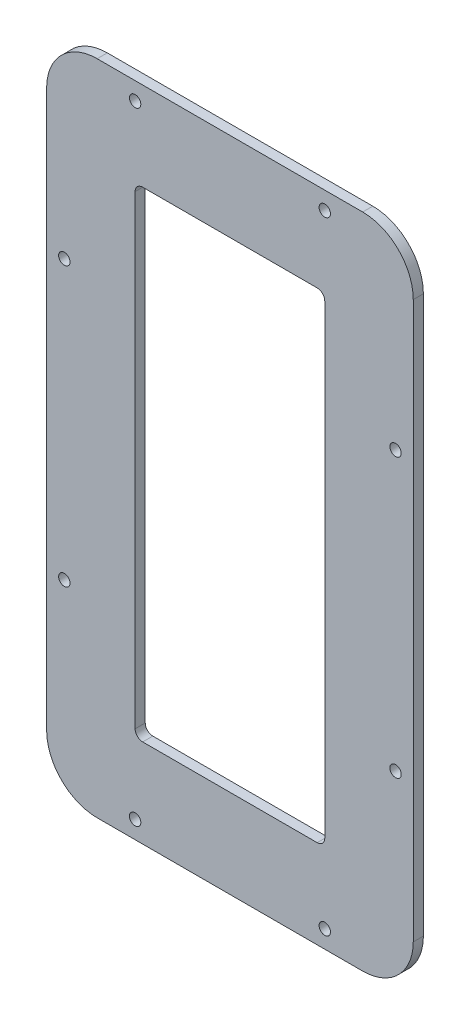
from build123d import *

# Parameters (mm, degrees)
ESBO_O1_W                = 145
ESBO_O1_H                = 260
RESSALTO_EXTRUS_O1_DEPTH = 4
FURO_COM_FOLGA_DE_M41_D  = 4.5
FILETE1_R                = 20


with BuildPart() as part:
    # Esboço1 → Ressalto-extrusão1 (new body)
    with BuildSketch(Plane.XY):
        Rectangle(ESBO_O1_W, ESBO_O1_H)
        with BuildLine():
            Line((-34.5, -95), (34.5, -95))
            ThreePointArc((34.5, -95), (36.621320344, -94.121320344), (37.5, -92))
            Line((37.5, -92), (37.5, 92))
            ThreePointArc((37.5, 92), (36.621320344, 94.121320344), (34.5, 95))
            Line((34.5, 95), (-34.5, 95))
            ThreePointArc((-34.5, 95), (-36.621320344, 94.121320344), (-37.5, 92))
            Line((-37.5, 92), (-37.5, -92))
            ThreePointArc((-37.5, -92), (-36.621320344, -94.121320344), (-34.5, -95))
        make_face(mode=Mode.SUBTRACT)
    extrude(amount=RESSALTO_EXTRUS_O1_DEPTH)

    # Furo com folga de M41 (through all)
    with Locations(Plane.XY.offset(4)):
        with Locations((-37.5, 123), (37.5, 123), (65.5, 55), (65.5, -55), (37.5, -123), (-37.5, -123), (-65.5, -55), (-65.5, 55)):
            Hole(FURO_COM_FOLGA_DE_M41_D / 2)

    # Filete1
    filete1_edges = [part.edges().sort_by_distance(p)[0] for p in [
        (72.5, -130, 2),
        (-72.5, -130, 2),
        (-72.5, 130, 2),
        (72.5, 130, 2),
    ]]
    fillet(filete1_edges, radius=FILETE1_R)


solid = part.part
